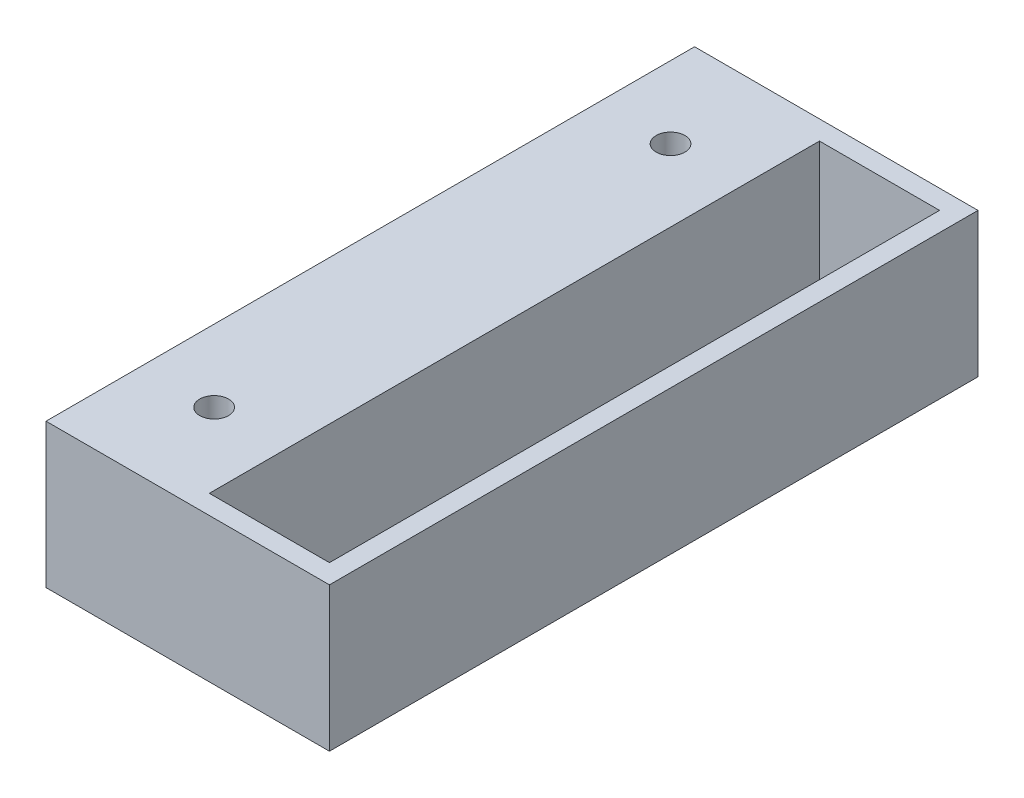
from build123d import *

# Parameters (mm, degrees)
CROQUIS1_R              = 1.5
CROQUIS1_W              = 12.5
CROQUIS1_H              = 63.5
SALIENTE_EXTRUIR1_DEPTH = 15


with BuildPart() as part:
    # Croquis1 → Saliente-Extruir1 (new body)
    with BuildSketch(Plane(origin=(0, 0, 0), x_dir=(1, 0, 0), z_dir=(0, 1, 0))):
        Polygon((-8.25, 33.75), (8.25, 33.75), (8.25, -33.75), (-8.25, -33.75), (-21.25, -33.75), (-21.25, 33.75), align=None)
        with Locations(Location((-13.75, -23.75, 0), (0, 0, 270))):
            Circle(CROQUIS1_R, mode=Mode.SUBTRACT)
        with Locations(Location((-13.75, 23.75, 0), (0, 0, 270))):
            Circle(CROQUIS1_R, mode=Mode.SUBTRACT)
        Rectangle(CROQUIS1_W, CROQUIS1_H, mode=Mode.SUBTRACT)
    extrude(amount=SALIENTE_EXTRUIR1_DEPTH)


solid = part.part
